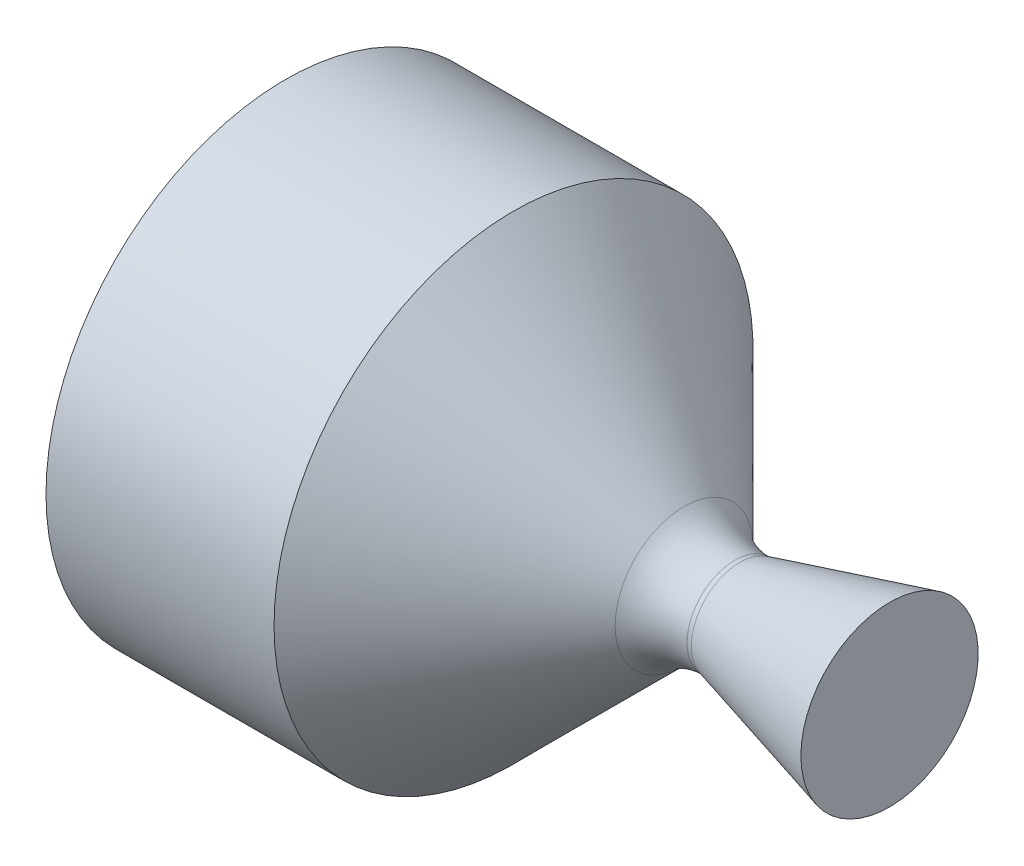
from build123d import *


with BuildPart() as part:
    # Sketch1 → Revolve1 (revolve)
    with BuildSketch(Plane.XY, mode=Mode.PRIVATE) as revolve1_sk:
        with BuildLine():
            Line((-13.36065, 28.0607), (13.36065, 28.0607))
            Line((13.36065, 28.0607), (33.34363095, 8.07771905))
            ThreePointArc((33.34363095, 8.07771905), (36.074675364, 6.252893513), (39.2961619, 5.6121))
            Line((39.2961619, 5.6121), (39.3061619, 5.6121))
            ThreePointArc((39.3061619, 5.6121), (39.599172317, 5.631304917), (39.887169245, 5.688591068))
            Line((39.887169245, 5.688591068), (57.419630863, 10.3864))
            Line((57.419630863, 10.3864), (57.419630863, 0))
            Line((57.419630863, 0), (-13.36065, 0))
            Line((-13.36065, 0), (-13.36065, 28.0607))
        make_face()
    revolve(revolve1_sk.sketch.rotate(Axis((0, 0, 0), (1, 0, 0)), 90), axis=Axis((0, 0, 0), (1, 0, 0)))


solid = part.part
